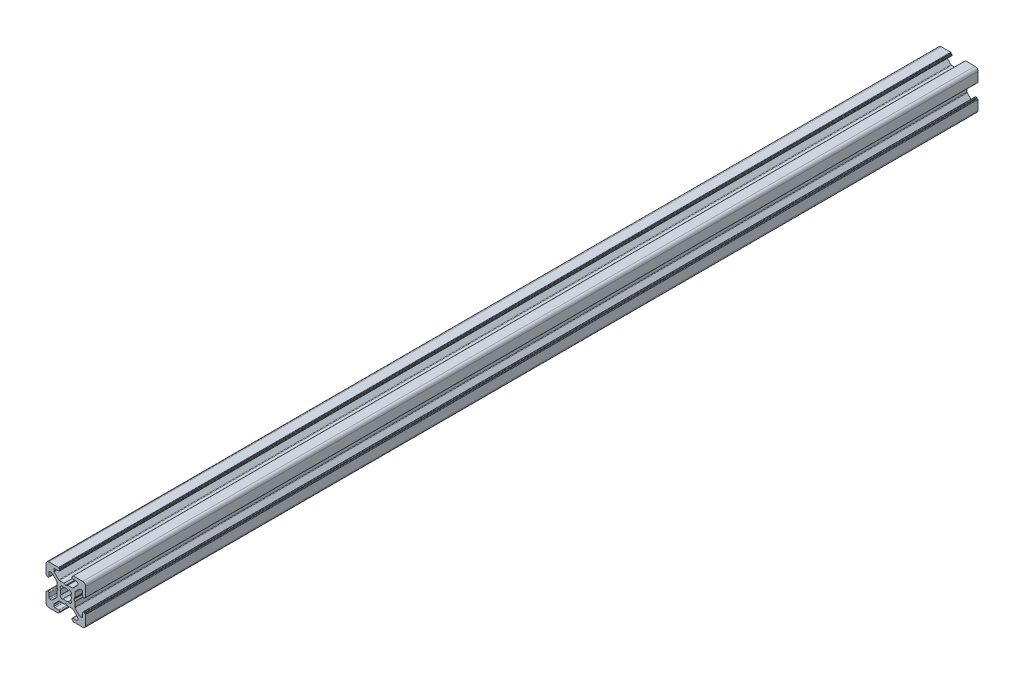
from build123d import *

# Parameters (mm, degrees)
EXTRUDE_583_DEPTH = 224.75


with BuildPart() as part:
    # Model → Extrude 583 (new, symmetric)
    with BuildSketch(Plane.XY):
        with BuildLine():
            Line((5.657855418, 4.59719506), (5.709619227, 4.790380225))
            Line((5.709619227, 4.790380225), (5.902804392, 4.842144034))
            Line((5.902804392, 4.842144034), (6.914213353, 5.853552995))
            ThreePointArc((6.914213353, 5.853552995), (7.076425027, 5.961939371), (7.267766744, 5.999999605))
            Line((7.267766744, 5.999999605), (7.999999732, 5.999999605))
            ThreePointArc((7.999999732, 5.999999605), (8.353553123, 5.853552995), (8.499999732, 5.499999605))
            Line((8.499999732, 5.499999605), (8.499999732, 3.6))
            ThreePointArc((8.499999732, 3.6), (8.646446341, 3.246446609), (8.999999732, 3.1))
            Line((8.999999732, 3.1), (9.300000059, 3.1))
            ThreePointArc((9.300000059, 3.1), (9.441421415, 3.158578644), (9.500000059, 3.3))
            Line((9.500000059, 3.3), (9.500000059, 3.350000228))
            ThreePointArc((9.500000059, 3.350000228), (9.558578702, 3.491421584), (9.700000059, 3.550000228))
            Line((9.700000059, 3.550000228), (9.800000059, 3.550000228))
            ThreePointArc((9.800000059, 3.550000228), (9.941421377, 3.608578892), (10, 3.750000228))
            Line((10, 3.750000228), (10, 8.5))
            ThreePointArc((10, 8.5), (9.560660172, 9.560660172), (8.5, 10))
            Line((8.5, 10), (3.750000228, 10))
            ThreePointArc((3.750000228, 10), (3.608578871, 9.941421356), (3.550000228, 9.8))
            Line((3.550000228, 9.8), (3.550000228, 9.7))
            ThreePointArc((3.550000228, 9.7), (3.491421584, 9.558578644), (3.350000228, 9.5))
            Line((3.350000228, 9.5), (3.3, 9.5))
            ThreePointArc((3.3, 9.5), (3.158578644, 9.441421356), (3.1, 9.3))
            Line((3.1, 9.3), (3.1, 8.999999673))
            ThreePointArc((3.1, 8.999999673), (3.246446609, 8.646446283), (3.6, 8.499999673))
            Line((3.6, 8.499999673), (5.500000686, 8.499999673))
            ThreePointArc((5.500000686, 8.499999673), (5.853554077, 8.353553064), (6.000000686, 7.999999673))
            Line((6.000000686, 7.999999673), (6.000000686, 7.267766626))
            ThreePointArc((6.000000686, 7.267766626), (5.961940448, 7.076424899), (5.853554059, 6.914213219))
            Line((5.853554059, 6.914213219), (3.585787212, 4.646446592))
            ThreePointArc((3.585787212, 4.646446592), (3.423575544, 4.538060229), (3.232233839, 4.5))
            Line((3.232233839, 4.5), (0.953590312, 4.5))
            ThreePointArc((0.953590312, 4.5), (0.901826505, 4.493185166), (0.853590316, 4.473205083))
            Line((0.853590316, 4.473205083), (0.100000045, 4.038119562))
            ThreePointArc((0.100000045, 4.038119562), (0, 4.011324632), (-0.100000045, 4.038119562))
            Line((-0.100000045, 4.038119562), (-0.853590316, 4.473205083))
            ThreePointArc((-0.853590316, 4.473205083), (-0.901826505, 4.493185166), (-0.953590312, 4.5))
            Line((-0.953590312, 4.5), (-3.232233839, 4.5))
            ThreePointArc((-3.232233839, 4.5), (-3.423575544, 4.538060229), (-3.585787212, 4.646446592))
            Line((-3.585787212, 4.646446592), (-5.853554059, 6.914213219))
            ThreePointArc((-5.853554059, 6.914213219), (-5.961940448, 7.076424899), (-6.000000686, 7.267766626))
            Line((-6.000000686, 7.267766626), (-6.000000686, 7.999999673))
            ThreePointArc((-6.000000686, 7.999999673), (-5.853554077, 8.353553064), (-5.500000686, 8.499999673))
            Line((-5.500000686, 8.499999673), (-3.6, 8.499999673))
            ThreePointArc((-3.6, 8.499999673), (-3.246446609, 8.646446283), (-3.1, 8.999999673))
            Line((-3.1, 8.999999673), (-3.1, 9.3))
            ThreePointArc((-3.1, 9.3), (-3.158578644, 9.441421356), (-3.3, 9.5))
            Line((-3.3, 9.5), (-3.350000228, 9.5))
            ThreePointArc((-3.350000228, 9.5), (-3.491421584, 9.558578644), (-3.550000228, 9.7))
            Line((-3.550000228, 9.7), (-3.550000228, 9.8))
            ThreePointArc((-3.550000228, 9.8), (-3.608578871, 9.941421356), (-3.750000228, 10))
            Line((-3.750000228, 10), (-8.5, 10))
            ThreePointArc((-8.5, 10), (-9.560660172, 9.560660172), (-10, 8.5))
            Line((-10, 8.5), (-10, 3.750000228))
            ThreePointArc((-10, 3.750000228), (-9.941421356, 3.608578871), (-9.8, 3.550000228))
            Line((-9.8, 3.550000228), (-9.7, 3.550000228))
            ThreePointArc((-9.7, 3.550000228), (-9.558578644, 3.491421584), (-9.5, 3.350000228))
            Line((-9.5, 3.350000228), (-9.5, 3.3))
            ThreePointArc((-9.5, 3.3), (-9.441421356, 3.158578644), (-9.3, 3.1))
            Line((-9.3, 3.1), (-8.999999673, 3.1))
            ThreePointArc((-8.999999673, 3.1), (-8.646446283, 3.246446609), (-8.499999673, 3.6))
            Line((-8.499999673, 3.6), (-8.499999673, 5.499999605))
            ThreePointArc((-8.499999673, 5.499999605), (-8.353553064, 5.853552995), (-7.999999673, 5.999999605))
            Line((-7.999999673, 5.999999605), (-7.267766626, 5.999999605))
            ThreePointArc((-7.267766626, 5.999999605), (-7.07642491, 5.961939371), (-6.914213236, 5.853552995))
            Line((-6.914213236, 5.853552995), (-4.64644634, 3.585786099))
            ThreePointArc((-4.64644634, 3.585786099), (-4.538059964, 3.423574425), (-4.49999973, 3.232232708))
            Line((-4.49999973, 3.232232708), (-4.49999973, 0.953589302))
            ThreePointArc((-4.49999973, 0.953589302), (-4.493184895, 0.90182549), (-4.473204808, 0.853589297))
            Line((-4.473204808, 0.853589297), (-4.038119782, 0.099999969))
            ThreePointArc((-4.038119782, 0.099999969), (-4.01132487, 0), (-4.038119782, -0.099999969))
            Line((-4.038119782, -0.099999969), (-4.473204808, -0.853589297))
            ThreePointArc((-4.473204808, -0.853589297), (-4.493184895, -0.90182549), (-4.49999973, -0.953589302))
            Line((-4.49999973, -0.953589302), (-4.49999973, -3.232232708))
            ThreePointArc((-4.49999973, -3.232232708), (-4.538059964, -3.423574425), (-4.64644634, -3.585786099))
            Line((-4.64644634, -3.585786099), (-6.914213236, -5.853552995))
            ThreePointArc((-6.914213236, -5.853552995), (-7.07642491, -5.961939371), (-7.267766626, -5.999999605))
            Line((-7.267766626, -5.999999605), (-7.999999615, -5.999999605))
            ThreePointArc((-7.999999615, -5.999999605), (-8.353553005, -5.853552995), (-8.499999615, -5.499999605))
            Line((-8.499999615, -5.499999605), (-8.499999615, -3.6))
            ThreePointArc((-8.499999615, -3.6), (-8.646446224, -3.246446609), (-8.999999615, -3.1))
            Line((-8.999999615, -3.1), (-9.299999941, -3.1))
            ThreePointArc((-9.299999941, -3.1), (-9.441421298, -3.158578644), (-9.499999941, -3.3))
            Line((-9.499999941, -3.3), (-9.499999941, -3.350000228))
            ThreePointArc((-9.499999941, -3.350000228), (-9.558578585, -3.491421584), (-9.699999941, -3.550000228))
            Line((-9.699999941, -3.550000228), (-9.799999941, -3.550000228))
            ThreePointArc((-9.799999941, -3.550000228), (-9.941421298, -3.608578871), (-9.999999941, -3.750000228))
            Line((-9.999999941, -3.750000228), (-9.999999941, -8.5))
            ThreePointArc((-9.999999941, -8.5), (-9.560660113, -9.560660172), (-8.499999941, -10))
            Line((-8.499999941, -10), (-3.750000169, -10))
            ThreePointArc((-3.750000169, -10), (-3.608578813, -9.941421356), (-3.550000169, -9.8))
            Line((-3.550000169, -9.8), (-3.550000169, -9.7))
            ThreePointArc((-3.550000169, -9.7), (-3.491421525, -9.558578644), (-3.350000169, -9.5))
            Line((-3.350000169, -9.5), (-3.299999941, -9.5))
            ThreePointArc((-3.299999941, -9.5), (-3.158578585, -9.441421356), (-3.099999941, -9.3))
            Line((-3.099999941, -9.3), (-3.099999941, -8.999999673))
            ThreePointArc((-3.099999941, -8.999999673), (-3.246446551, -8.646446283), (-3.599999941, -8.499999673))
            Line((-3.599999941, -8.499999673), (-5.500000627, -8.499999673))
            ThreePointArc((-5.500000627, -8.499999673), (-5.853554018, -8.353553064), (-6.000000627, -7.999999673))
            Line((-6.000000627, -7.999999673), (-6.000000627, -7.267766626))
            ThreePointArc((-6.000000627, -7.267766626), (-5.961940389, -7.076424899), (-5.853554001, -6.914213219))
            Line((-5.853554001, -6.914213219), (-3.585787153, -4.646446592))
            ThreePointArc((-3.585787153, -4.646446592), (-3.423575485, -4.538060229), (-3.23223378, -4.5))
            Line((-3.23223378, -4.5), (-0.953590253, -4.5))
            ThreePointArc((-0.953590253, -4.5), (-0.901826446, -4.493185166), (-0.853590257, -4.473205083))
            Line((-0.853590257, -4.473205083), (-0.099999986, -4.038119562))
            ThreePointArc((-0.099999986, -4.038119562), (5.9e-08, -4.011324632), (0.100000103, -4.038119562))
            Line((0.100000103, -4.038119562), (0.853590375, -4.473205083))
            ThreePointArc((0.853590375, -4.473205083), (0.901826564, -4.493185166), (0.95359037, -4.5))
            Line((0.95359037, -4.5), (3.232233897, -4.5))
            ThreePointArc((3.232233897, -4.5), (3.423575602, -4.538060229), (3.585787271, -4.646446592))
            Line((3.585787271, -4.646446592), (5.853554118, -6.914213219))
            ThreePointArc((5.853554118, -6.914213219), (5.961940506, -7.076424899), (6.000000745, -7.267766626))
            Line((6.000000745, -7.267766626), (6.000000745, -7.999999673))
            ThreePointArc((6.000000745, -7.999999673), (5.853554135, -8.353553064), (5.500000745, -8.499999673))
            Line((5.500000745, -8.499999673), (3.600000059, -8.499999673))
            ThreePointArc((3.600000059, -8.499999673), (3.246446668, -8.646446283), (3.100000059, -8.999999673))
            Line((3.100000059, -8.999999673), (3.100000059, -9.3))
            ThreePointArc((3.100000059, -9.3), (3.158578702, -9.441421356), (3.300000059, -9.5))
            Line((3.300000059, -9.5), (3.350000286, -9.5))
            ThreePointArc((3.350000286, -9.5), (3.491421642, -9.558578644), (3.550000286, -9.7))
            Line((3.550000286, -9.7), (3.550000286, -9.8))
            ThreePointArc((3.550000286, -9.8), (3.60857893, -9.941421356), (3.750000286, -10))
            Line((3.750000286, -10), (8.500000059, -10))
            ThreePointArc((8.500000059, -10), (9.56066023, -9.560660172), (10.000000059, -8.5))
            Line((10.000000059, -8.5), (10.000000059, -3.750000228))
            ThreePointArc((10.000000059, -3.750000228), (9.941421415, -3.608578871), (9.800000059, -3.550000228))
            Line((9.800000059, -3.550000228), (9.700000059, -3.550000228))
            ThreePointArc((9.700000059, -3.550000228), (9.558578702, -3.491421584), (9.500000059, -3.350000228))
            Line((9.500000059, -3.350000228), (9.500000059, -3.3))
            ThreePointArc((9.500000059, -3.3), (9.441421415, -3.158578644), (9.300000059, -3.1))
            Line((9.300000059, -3.1), (8.999999732, -3.1))
            ThreePointArc((8.999999732, -3.1), (8.646446341, -3.246446609), (8.499999732, -3.6))
            Line((8.499999732, -3.6), (8.499999732, -5.499999697))
            ThreePointArc((8.499999732, -5.499999697), (8.353553138, -5.853553034), (7.999999791, -5.999999605))
            Line((7.999999791, -5.999999605), (7.267766744, -5.999999605))
            ThreePointArc((7.267766744, -5.999999605), (7.076425027, -5.961939371), (6.914213353, -5.853552995))
            Line((6.914213353, -5.853552995), (4.646446457, -3.585786099))
            ThreePointArc((4.646446457, -3.585786099), (4.538060081, -3.423574425), (4.499999847, -3.232232708))
            Line((4.499999847, -3.232232708), (4.499999847, -0.953589302))
            ThreePointArc((4.499999847, -0.953589302), (4.493185012, -0.90182549), (4.473204926, -0.853589297))
            Line((4.473204926, -0.853589297), (4.0381199, -0.099999969))
            ThreePointArc((4.0381199, -0.099999969), (4.011324987, 0), (4.0381199, 0.099999969))
            Line((4.0381199, 0.099999969), (4.473204926, 0.853589297))
            ThreePointArc((4.473204926, 0.853589297), (4.493185012, 0.90182549), (4.499999847, 0.953589302))
            Line((4.499999847, 0.953589302), (4.499999847, 3.232232708))
            ThreePointArc((4.499999847, 3.232232708), (4.538060081, 3.423574425), (4.646446457, 3.585786099))
            Line((4.646446457, 3.585786099), (5.657855418, 4.59719506))
        make_face()
        with BuildLine():
            Line((-1.91389502, 2.989640962), (-1.258185436, 2.445295362))
            ThreePointArc((-1.258185436, 2.445295362), (0, 2.75), (1.258185436, 2.445295362))
            Line((1.258185436, 2.445295362), (1.91389502, 2.989640962))
            ThreePointArc((1.91389502, 2.989640962), (2.511737261, 2.508410485), (2.992174953, 1.909930962))
            Line((2.992174953, 1.909930962), (2.445295423, 1.258185317))
            ThreePointArc((2.445295423, 1.258185317), (2.75, 0), (2.445295423, -1.258185317))
            Line((2.445295423, -1.258185317), (2.992174953, -1.909930962))
            ThreePointArc((2.992174953, -1.909930962), (2.511737261, -2.508410485), (1.91389502, -2.989640962))
            Line((1.91389502, -2.989640962), (1.258185436, -2.445295362))
            ThreePointArc((1.258185436, -2.445295362), (0, -2.75), (-1.258185436, -2.445295362))
            Line((-1.258185436, -2.445295362), (-1.91389502, -2.989640962))
            ThreePointArc((-1.91389502, -2.989640962), (-2.511737261, -2.508410485), (-2.992174953, -1.909930962))
            Line((-2.992174953, -1.909930962), (-2.445295423, -1.258185317))
            ThreePointArc((-2.445295423, -1.258185317), (-2.75, 0), (-2.445295423, 1.258185317))
            Line((-2.445295423, 1.258185317), (-2.992174953, 1.909930962))
            ThreePointArc((-2.992174953, 1.909930962), (-2.511737261, 2.508410485), (-1.91389502, 2.989640962))
        make_face(mode=Mode.SUBTRACT)
    extrude(amount=EXTRUDE_583_DEPTH, both=True)


solid = part.part
